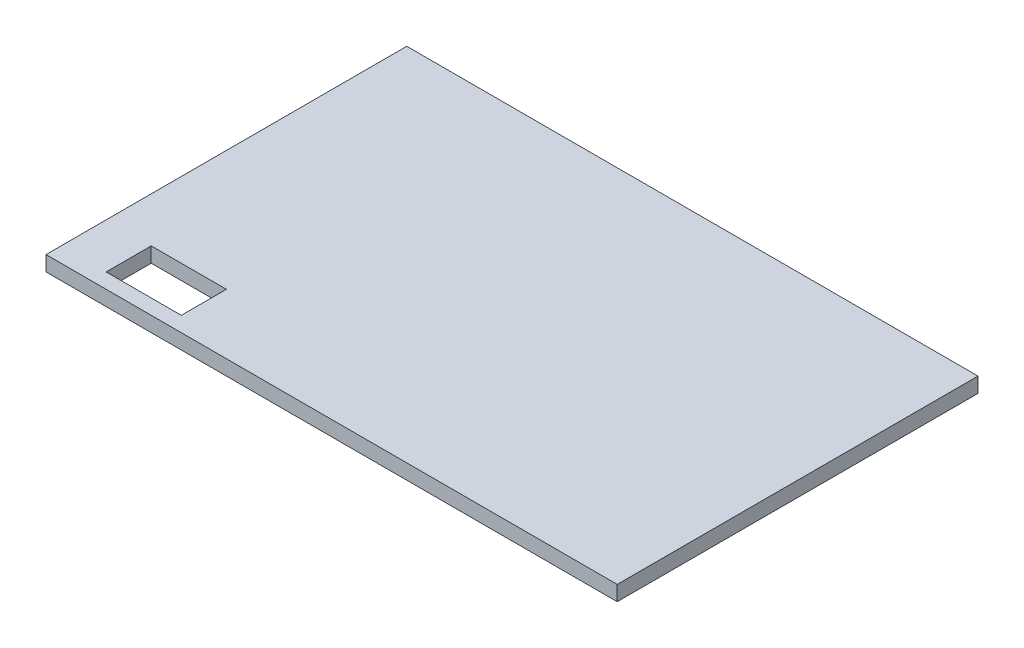
from build123d import *

# Parameters (mm, degrees)
SKETCH1_W           = 40
SKETCH1_H           = 24
BOSS_EXTRUDE1_DEPTH = 2
SKETCH2_W           = 40
SKETCH2_H           = 24
SKETCH2_W_2         = 36
SKETCH2_H_2         = 22
BOSS_EXTRUDE3_DEPTH = 8
SKETCH5_W           = 4
SKETCH5_H           = 3
CUT_EXTRUDE1_DEPTH  = 2
SKETCH6_W           = 24
SKETCH6_H           = 10
CUT_EXTRUDE2_DEPTH  = 2
SKETCH7_W           = 22
SKETCH7_H           = 8
CUT_EXTRUDE3_DEPTH  = 2
SKETCH8_W           = 1
SKETCH8_H           = 3
CUT_EXTRUDE4_DEPTH  = 2
SKETCH9_W           = 38
SKETCH9_H           = 24
CUT_EXTRUDE5_DEPTH  = 9


with BuildPart() as part:
    # Sketch1 → Boss-Extrude1 (new body)
    with BuildSketch(Plane(origin=(0, 0, 0), x_dir=(1, 0, 0), z_dir=(0, 1, 0))):
        with Locations((20, 12)):
            Rectangle(SKETCH1_W, SKETCH1_H)
    extrude(amount=BOSS_EXTRUDE1_DEPTH)

    # Sketch2 → Boss-Extrude3 (add)
    with BuildSketch(Plane(origin=(0, 2, 0), x_dir=(1, 0, 0), z_dir=(0, 1, 0))):
        with Locations((20, 12)):
            Rectangle(SKETCH2_W, SKETCH2_H)
        with Locations((21, 12)):
            Rectangle(SKETCH2_W_2, SKETCH2_H_2, mode=Mode.SUBTRACT)
    extrude(amount=BOSS_EXTRUDE3_DEPTH)

    # Sketch5 → Cut-Extrude1 (cut)
    with BuildSketch(Plane(origin=(0, 2, 0), x_dir=(1, 0, 0), z_dir=(0, 1, 0))):
        with Locations((6, 2.5)):
            Rectangle(SKETCH5_W, SKETCH5_H)
    extrude(amount=-CUT_EXTRUDE1_DEPTH, mode=Mode.SUBTRACT)

    # Sketch6 → Cut-Extrude2 (cut)
    with BuildSketch(Plane(origin=(40, 0, 0), x_dir=(0, 0, -1), z_dir=(1, 0, 0))):
        with Locations((12, 5)):
            Rectangle(SKETCH6_W, SKETCH6_H)
    extrude(amount=-CUT_EXTRUDE2_DEPTH, mode=Mode.SUBTRACT)

    # Sketch7 → Cut-Extrude3 (cut)
    with BuildSketch(Plane(origin=(3, 0, 0), x_dir=(0, 0, -1), z_dir=(1, 0, 0))):
        with Locations((12, 6)):
            Rectangle(SKETCH7_W, SKETCH7_H)
    extrude(amount=-CUT_EXTRUDE3_DEPTH, mode=Mode.SUBTRACT)

    # Sketch8 → Cut-Extrude4 (cut)
    with BuildSketch(Plane(origin=(0, 2, 0), x_dir=(1, 0, 0), z_dir=(0, 1, 0))):
        with Locations((3.5, 2.5)):
            Rectangle(SKETCH8_W, SKETCH8_H)
    extrude(amount=-CUT_EXTRUDE4_DEPTH, mode=Mode.SUBTRACT)

    # Sketch9 → Cut-Extrude5 (cut)
    with BuildSketch(Plane(origin=(0, 10, 0), x_dir=(1, 0, 0), z_dir=(0, 1, 0))):
        with Locations((19, 12)):
            Rectangle(SKETCH9_W, SKETCH9_H)
    extrude(amount=-CUT_EXTRUDE5_DEPTH, mode=Mode.SUBTRACT)


solid = part.part
